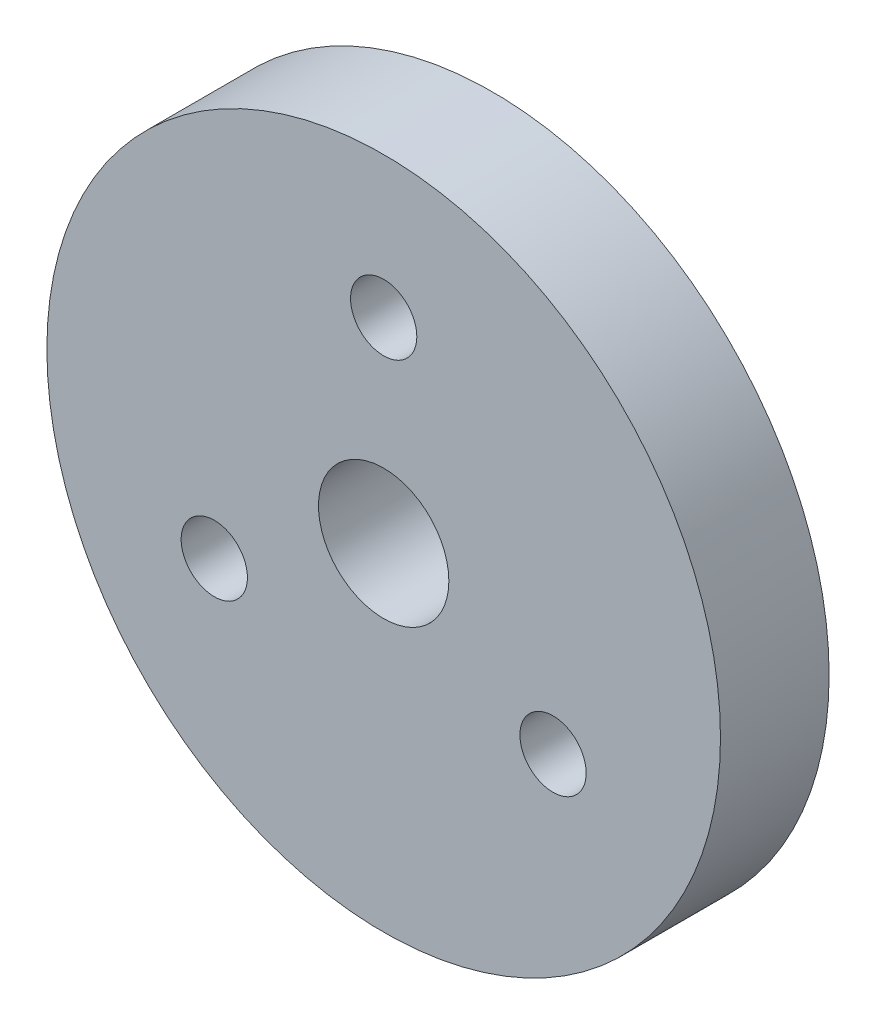
from build123d import *

# Parameters (mm, degrees)
SKETCH1_R               = 15.5
BOSS_EXTRUDE1_DEPTH     = 5
CUT_EXTRUDE1_REACH      = 24.483
SKETCH2_R               = 3
CUT_EXTRUDE2_DEPTH      = 23.483327156
CUT_EXTRUDE2_DEPTH_BACK = 23.483327156
SKETCH3_R               = 1.525


with BuildPart() as part:
    # Sketch1 → Boss-Extrude1 (new body)
    with BuildSketch(Plane.XY):
        Circle(SKETCH1_R)
    extrude(amount=BOSS_EXTRUDE1_DEPTH)

    # Sketch2 → Cut-Extrude1 (cut, up to next)
    with BuildSketch(Plane.XY.offset(5), mode=Mode.PRIVATE) as cut_extrude1_sk1:
        Circle(SKETCH2_R)
    cut_extrude1_tool1 = extrude(cut_extrude1_sk1.sketch, amount=-CUT_EXTRUDE1_REACH, mode=Mode.PRIVATE) & part.part
    add(cut_extrude1_tool1.solids().sort_by_distance((0, 0, 5))[0], mode=Mode.SUBTRACT)

    # Sketch3 → Cut-Extrude2 (cut, two sides: drawn at the far end of the back side and taken through both)
    with BuildSketch(Plane.XY.offset(5).offset(-CUT_EXTRUDE2_DEPTH_BACK)):
        with Locations((0, 9)):
            Circle(SKETCH3_R)
        with Locations((7.794228634, -4.5)):
            Circle(SKETCH3_R)
        with Locations((-7.794228634, -4.5)):
            Circle(SKETCH3_R)
    extrude(amount=CUT_EXTRUDE2_DEPTH + CUT_EXTRUDE2_DEPTH_BACK, mode=Mode.SUBTRACT)


solid = part.part
